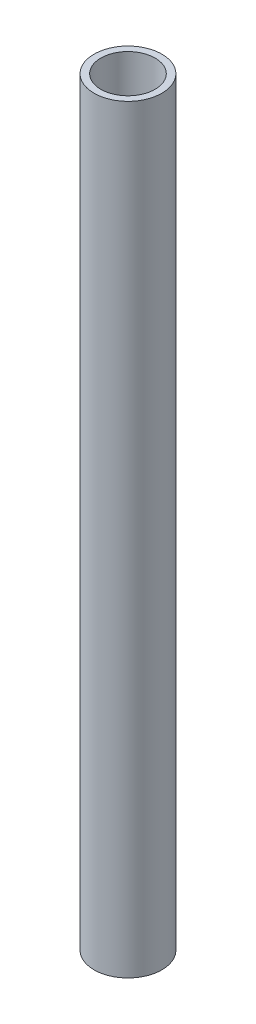
from build123d import *

# Parameters (mm, degrees)
SKETCH_1_R      = 5
SKETCH_1_R_2    = 4
EXTRUDE_1_DEPTH = 112


with BuildPart() as part:
    # Эскиз1 → Бобышка-Вытянуть1 (new body)
    with BuildSketch(Plane(origin=(0, 0, 0), x_dir=(1, 0, 0), z_dir=(0, 1, 0))):
        with Locations(Location((0, 0, 0), (0, 0, 270))):
            Circle(SKETCH_1_R)
        with Locations(Location((0, 0, 0), (0, 0, 270))):
            Circle(SKETCH_1_R_2, mode=Mode.SUBTRACT)
    extrude(amount=EXTRUDE_1_DEPTH)


solid = part.part
